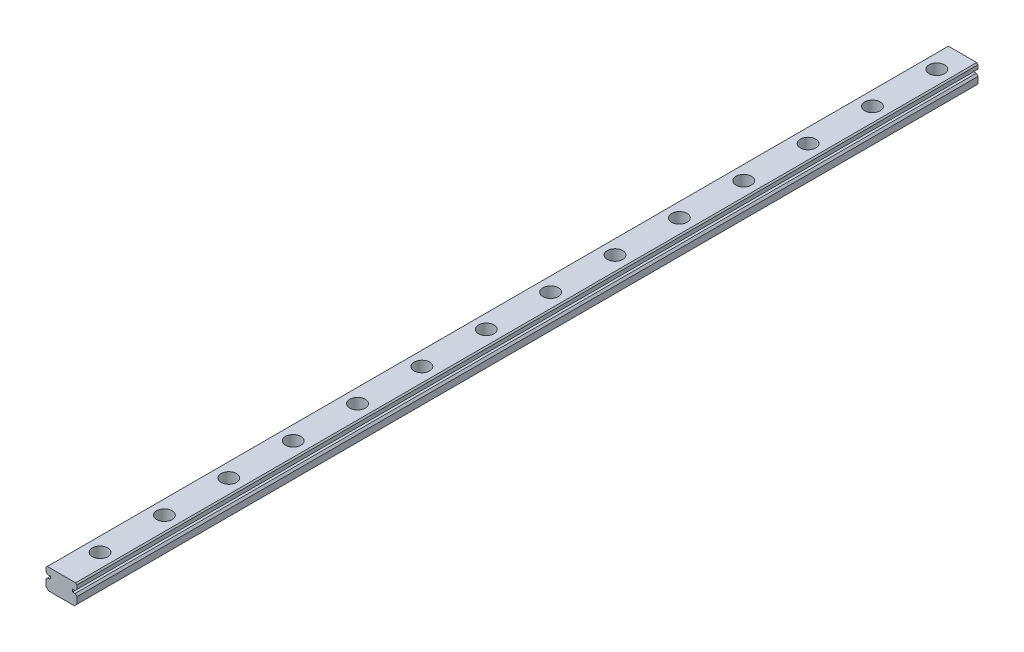
from build123d import *

# Parameters (mm, degrees)
MAIN_EXTRUSION_DEPTH             = 350
MOUNTING_HOLE_MASTER_D           = 3.5
MOUNTING_HOLE_MASTER_DEPTH       = 9.921567416
MOUNTING_HOLE_MASTER_CBORE_D     = 6
MOUNTING_HOLE_MASTER_CBORE_DEPTH = 4.5
MOUNTING_HOLES_PATTERN_COUNT     = 14
MOUNTING_HOLES_PATTERN_PITCH     = 25
RAIL_TOP_CHAMFER_SIZE            = 0.5
RAIL_BOTTOM_CHAMFER_SIZE         = 1


with BuildPart() as part:
    # MainProfile → Main Extrusion (new body)
    with BuildSketch(Plane.XY):
        Polygon((0, 0), (0, 3.585786438), (0.707106781, 4.292893219), (1.707106781, 4.292893219), (1.707106781, 5.292893219), (0.707106781, 5.292893219), (0, 6), (0, 8), (12, 8), (12, 6), (11.292893219, 5.292893219), (10.292893219, 5.292893219), (10.292893219, 4.292893219), (11.292893219, 4.292893219), (12, 3.585786438), (12, 0), align=None)
    extrude(amount=MAIN_EXTRUSION_DEPTH)

    # Mounting Hole Master
    with Locations(Plane(origin=(0, 8, 0), x_dir=(1, 0, 0), z_dir=(0, 1, 0))):
        with Locations((6, -10)):
            mounting_hole_master = CounterBoreHole(MOUNTING_HOLE_MASTER_D / 2, MOUNTING_HOLE_MASTER_CBORE_D / 2, MOUNTING_HOLE_MASTER_CBORE_DEPTH, depth=MOUNTING_HOLE_MASTER_DEPTH)

    # Mounting Holes Pattern: Mounting Hole Master ×14
    with Locations(*[(0, 0, i * MOUNTING_HOLES_PATTERN_PITCH) for i in range(1, MOUNTING_HOLES_PATTERN_COUNT)]):
        add(mounting_hole_master, mode=Mode.SUBTRACT)

    # Rail Top Chamfer
    rail_top_chamfer_edges = [part.edges().sort_by_distance(p)[0] for p in [
        (12, 8, 175),
        (0, 8, 175),
    ]]
    chamfer(rail_top_chamfer_edges, length=RAIL_TOP_CHAMFER_SIZE)

    # Rail Bottom Chamfer
    rail_bottom_chamfer_edges = [part.edges().sort_by_distance(p)[0] for p in [
        (0, 0, 175),
        (12, 0, 175),
    ]]
    chamfer(rail_bottom_chamfer_edges, length=RAIL_BOTTOM_CHAMFER_SIZE)


solid = part.part
